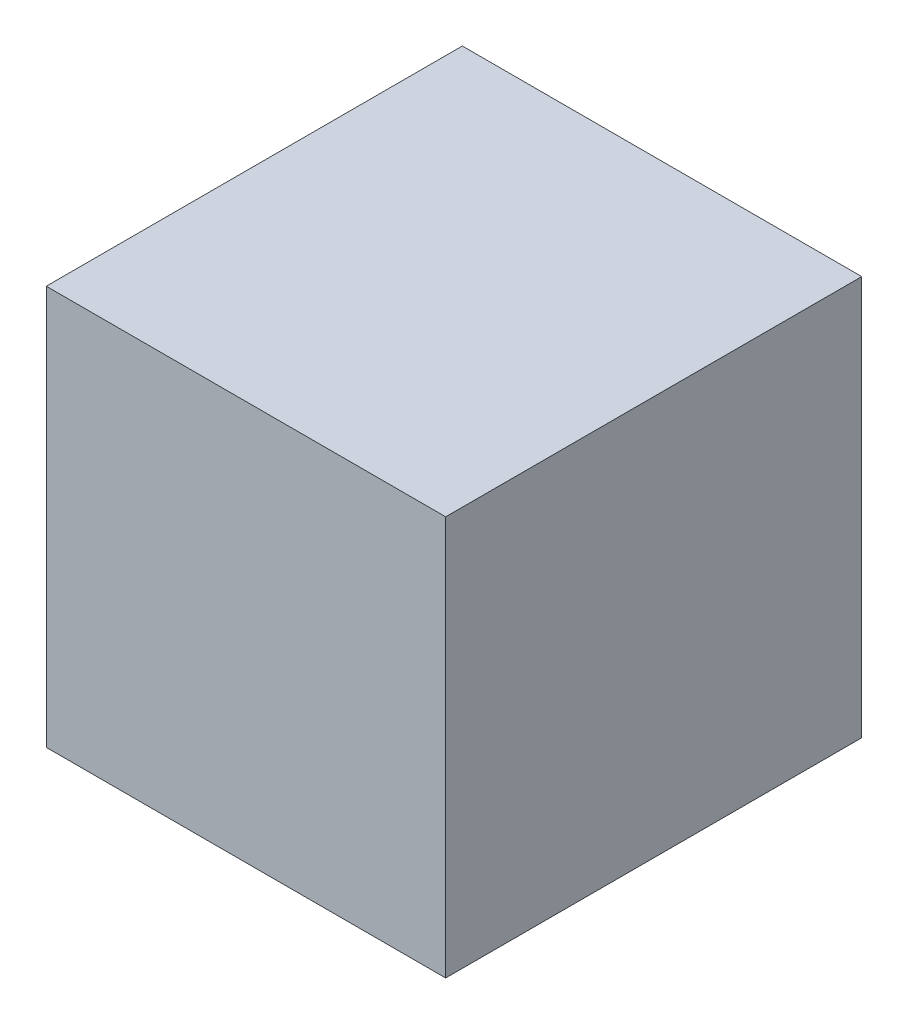
from build123d import *

# Parameters (mm, degrees)
CROQUIS1_W              = 48
CROQUIS1_H              = 48
SALIENTE_EXTRUIR1_DEPTH = 50
CROQUIS3_R              = 5
CORTAR_EXTRUIR2_DEPTH   = 10


with BuildPart() as part:
    # Croquis1 → Saliente-Extruir1 (new body)
    with BuildSketch(Plane.XY):
        Rectangle(CROQUIS1_W, CROQUIS1_H)
    extrude(amount=SALIENTE_EXTRUIR1_DEPTH)

    # Croquis3 → Cortar-Extruir2 (cut)
    with BuildSketch(Plane.ZY.offset(24)):
        with Locations(Location((26, 0, 0), (0, 0, 270))):
            Circle(CROQUIS3_R)
    extrude(amount=-CORTAR_EXTRUIR2_DEPTH, mode=Mode.SUBTRACT)


solid = part.part
